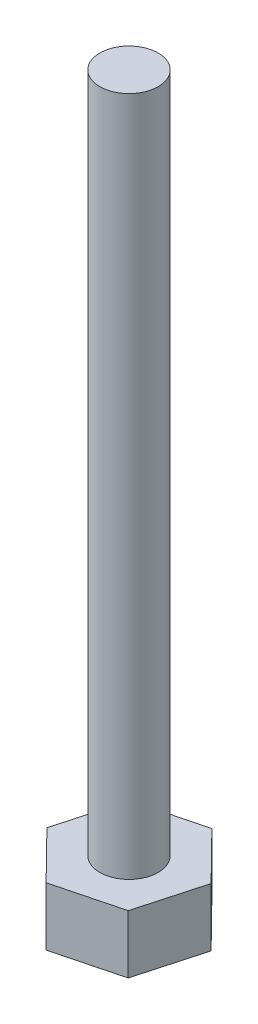
from build123d import *

# Parameters (mm, degrees)
BOSS_EXTRU_1_DEPTH = 3
ESQUISSE2_W        = 1.5
ESQUISSE2_H        = 35


with BuildPart() as part:
    # Esquisse1 → Boss.-Extru.1 (new body)
    with BuildSketch(Plane.XZ.offset(38)):
        Polygon((0.924188604, -3.338543908), (3.353358138, -0.868901145), (2.429169534, 2.469642763), (-0.924188604, 3.338543908), (-3.353358138, 0.868901145), (-2.429169534, -2.469642763), align=None)
    extrude(amount=-BOSS_EXTRU_1_DEPTH)

    # Esquisse2 → Révolution1 (revolve)
    with BuildSketch(Plane(origin=(0, 0, 0), x_dir=(-1, 0, 0), z_dir=(0, 0, -1)), mode=Mode.PRIVATE) as r_volution1_sk:
        with Locations((-0.75, -17.5)):
            Rectangle(ESQUISSE2_W, ESQUISSE2_H)
    revolve(r_volution1_sk.sketch.rotate(Axis((0, -35, 0), (0, 1, 0)), 270), axis=Axis((0, -35, 0), (0, 1, 0)))


solid = part.part
